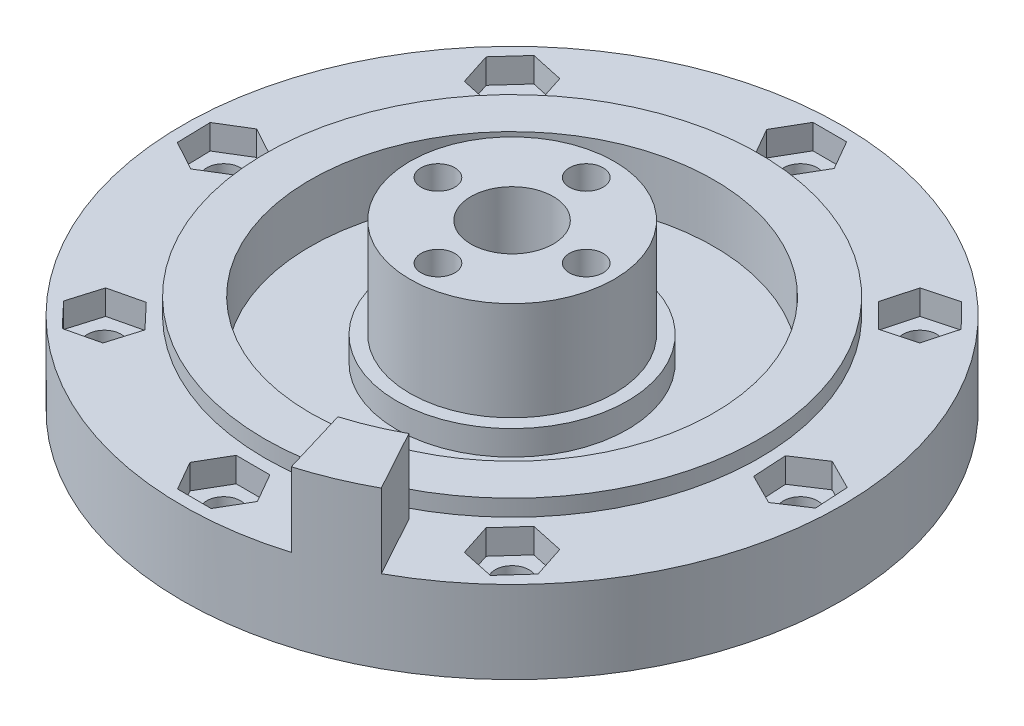
from build123d import *

# Parameters (mm, degrees)
SKETCH1_R           = 40
BOSS_EXTRUDE1_DEPTH = 10
SKETCH2_R           = 24.5
CUT_EXTRUDE1_DEPTH  = 5
BOSS_EXTRUDE2_START = 2
SKETCH3_R           = 30
SKETCH3_R_2         = 24.5
BOSS_EXTRUDE2_DEPTH = 2
SKETCH4_R           = 14
BOSS_EXTRUDE3_DEPTH = 3
SKETCH5_R           = 12.4
BOSS_EXTRUDE4_DEPTH = 12
SKETCH6_R           = 2.05
CUT_EXTRUDE2_DEPTH  = 61
SKETCH7_R           = 5
CUT_EXTRUDE3_DEPTH  = 61
CUT_EXTRUDE6_REACH  = 59.446
SKETCH9_R           = 2.05
CUT_EXTRUDE7_DEPTH  = 3
BOSS_EXTRUDE5_DEPTH = 9


with BuildPart() as part:
    # Sketch1 → Boss-Extrude1 (new body)
    with BuildSketch(Plane(origin=(0, 0, 0), x_dir=(1, 0, 0), z_dir=(0, 1, 0))):
        with Locations(Location((0, 0, 0), (0, 0, 270))):
            Circle(SKETCH1_R)
    extrude(amount=BOSS_EXTRUDE1_DEPTH)

    # Sketch2 → Cut-Extrude1 (cut)
    with BuildSketch(Plane(origin=(0, 10, 0), x_dir=(1, 0, 0), z_dir=(0, 1, 0))):
        with Locations(Location((0, 0, 0), (0, 0, 270))):
            Circle(SKETCH2_R)
    extrude(amount=-CUT_EXTRUDE1_DEPTH, mode=Mode.SUBTRACT)

    # Sketch3 → Boss-Extrude2 (add)
    with BuildSketch(Plane(origin=(0, 10, 0), x_dir=(1, 0, 0), z_dir=(0, 1, 0)).offset(BOSS_EXTRUDE2_START)):
        with Locations(Location((0, 0, 0), (0, 0, 270))):
            Circle(SKETCH3_R)
        with Locations(Location((0, 0, 0), (0, 0, 270))):
            Circle(SKETCH3_R_2, mode=Mode.SUBTRACT)
    extrude(amount=-BOSS_EXTRUDE2_DEPTH)

    # Sketch4 → Boss-Extrude3 (add)
    with BuildSketch(Plane(origin=(0, 5, 0), x_dir=(1, 0, 0), z_dir=(0, 1, 0))):
        with Locations(Location((0, 0, 0), (0, 0, 270))):
            Circle(SKETCH4_R)
    extrude(amount=BOSS_EXTRUDE3_DEPTH)

    # Sketch5 → Boss-Extrude4 (add)
    with BuildSketch(Plane(origin=(0, 8, 0), x_dir=(1, 0, 0), z_dir=(0, 1, 0))):
        with Locations(Location((0, 0, 0), (0, 0, 270))):
            Circle(SKETCH5_R)
    extrude(amount=BOSS_EXTRUDE4_DEPTH)

    # Sketch6 → Cut-Extrude2 (cut, through all)
    with BuildSketch(Plane(origin=(0, 20, 0), x_dir=(1, 0, 0), z_dir=(0, 1, 0))):
        with Locations(Location((-9, 0, 0), (0, 0, 270))):
            Circle(SKETCH6_R)
        with Locations(Location((0, 9, 0), (0, 0, 270))):
            Circle(SKETCH6_R)
        with Locations(Location((9, 0, 0), (0, 0, 270))):
            Circle(SKETCH6_R)
        with Locations(Location((0, -9, 0), (0, 0, 270))):
            Circle(SKETCH6_R)
    extrude(amount=-CUT_EXTRUDE2_DEPTH, mode=Mode.SUBTRACT)

    # Sketch7 → Cut-Extrude3 (cut, through all)
    with BuildSketch(Plane(origin=(0, 20, 0), x_dir=(1, 0, 0), z_dir=(0, 1, 0))):
        with Locations(Location((0, 0, 0), (0, 0, 270))):
            Circle(SKETCH7_R)
    extrude(amount=-CUT_EXTRUDE3_DEPTH, mode=Mode.SUBTRACT)

    # Sketch9 → Cut-Extrude6 (cut, up to next)
    with BuildSketch(Plane(origin=(0, 10, 0), x_dir=(1, 0, 0), z_dir=(0, 1, 0)), mode=Mode.PRIVATE) as cut_extrude6_sk1:
        with Locations(Location((0, 35, 0), (0, 0, 270))):
            Circle(SKETCH9_R)
    cut_extrude6_tool1 = extrude(cut_extrude6_sk1.sketch, amount=-CUT_EXTRUDE6_REACH, mode=Mode.PRIVATE) & part.part
    # Sketch9 → Cut-Extrude6 (cut, up to next)
    with BuildSketch(Plane(origin=(0, 10, 0), x_dir=(1, 0, 0), z_dir=(0, 1, 0)), mode=Mode.PRIVATE) as cut_extrude6_sk2:
        with Locations(Location((35, 0, 0), (0, 0, 270))):
            Circle(SKETCH9_R)
    cut_extrude6_tool2 = extrude(cut_extrude6_sk2.sketch, amount=-CUT_EXTRUDE6_REACH, mode=Mode.PRIVATE) & part.part
    # Sketch9 → Cut-Extrude6 (cut, up to next)
    with BuildSketch(Plane(origin=(0, 10, 0), x_dir=(1, 0, 0), z_dir=(0, 1, 0)), mode=Mode.PRIVATE) as cut_extrude6_sk3:
        with Locations(Location((0, -35, 0), (0, 0, 270))):
            Circle(SKETCH9_R)
    cut_extrude6_tool3 = extrude(cut_extrude6_sk3.sketch, amount=-CUT_EXTRUDE6_REACH, mode=Mode.PRIVATE) & part.part
    # Sketch9 → Cut-Extrude6 (cut, up to next)
    with BuildSketch(Plane(origin=(0, 10, 0), x_dir=(1, 0, 0), z_dir=(0, 1, 0)), mode=Mode.PRIVATE) as cut_extrude6_sk4:
        with Locations(Location((-35, 0, 0), (0, 0, 270))):
            Circle(SKETCH9_R)
    cut_extrude6_tool4 = extrude(cut_extrude6_sk4.sketch, amount=-CUT_EXTRUDE6_REACH, mode=Mode.PRIVATE) & part.part
    # Sketch9 → Cut-Extrude6 (cut, up to next)
    with BuildSketch(Plane(origin=(0, 10, 0), x_dir=(1, 0, 0), z_dir=(0, 1, 0)), mode=Mode.PRIVATE) as cut_extrude6_sk5:
        with Locations(Location((-24.748737342, 24.748737342, 0), (0, 0, 270))):
            Circle(SKETCH9_R)
    cut_extrude6_tool5 = extrude(cut_extrude6_sk5.sketch, amount=-CUT_EXTRUDE6_REACH, mode=Mode.PRIVATE) & part.part
    # Sketch9 → Cut-Extrude6 (cut, up to next)
    with BuildSketch(Plane(origin=(0, 10, 0), x_dir=(1, 0, 0), z_dir=(0, 1, 0)), mode=Mode.PRIVATE) as cut_extrude6_sk6:
        with Locations(Location((24.748737342, 24.748737342, 0), (0, 0, 270))):
            Circle(SKETCH9_R)
    cut_extrude6_tool6 = extrude(cut_extrude6_sk6.sketch, amount=-CUT_EXTRUDE6_REACH, mode=Mode.PRIVATE) & part.part
    # Sketch9 → Cut-Extrude6 (cut, up to next)
    with BuildSketch(Plane(origin=(0, 10, 0), x_dir=(1, 0, 0), z_dir=(0, 1, 0)), mode=Mode.PRIVATE) as cut_extrude6_sk7:
        with Locations(Location((24.748737342, -24.748737342, 0), (0, 0, 270))):
            Circle(SKETCH9_R)
    cut_extrude6_tool7 = extrude(cut_extrude6_sk7.sketch, amount=-CUT_EXTRUDE6_REACH, mode=Mode.PRIVATE) & part.part
    # Sketch9 → Cut-Extrude6 (cut, up to next)
    with BuildSketch(Plane(origin=(0, 10, 0), x_dir=(1, 0, 0), z_dir=(0, 1, 0)), mode=Mode.PRIVATE) as cut_extrude6_sk8:
        with Locations(Location((-24.748737342, -24.748737342, 0), (0, 0, 270))):
            Circle(SKETCH9_R)
    cut_extrude6_tool8 = extrude(cut_extrude6_sk8.sketch, amount=-CUT_EXTRUDE6_REACH, mode=Mode.PRIVATE) & part.part
    add(cut_extrude6_tool1.solids().sort_by_distance((0, 10, -35))[0], mode=Mode.SUBTRACT)
    add(cut_extrude6_tool2.solids().sort_by_distance((35, 10, 0))[0], mode=Mode.SUBTRACT)
    add(cut_extrude6_tool3.solids().sort_by_distance((0, 10, 35))[0], mode=Mode.SUBTRACT)
    add(cut_extrude6_tool4.solids().sort_by_distance((-35, 10, 0))[0], mode=Mode.SUBTRACT)
    add(cut_extrude6_tool5.solids().sort_by_distance((-24.748737, 10, -24.748737))[0], mode=Mode.SUBTRACT)
    add(cut_extrude6_tool6.solids().sort_by_distance((24.748737, 10, -24.748737))[0], mode=Mode.SUBTRACT)
    add(cut_extrude6_tool7.solids().sort_by_distance((24.748737, 10, 24.748737))[0], mode=Mode.SUBTRACT)
    add(cut_extrude6_tool8.solids().sort_by_distance((-24.748737, 10, 24.748737))[0], mode=Mode.SUBTRACT)

    # Sketch10 → Cut-Extrude7 (cut)
    with BuildSketch(Plane(origin=(0, 10, 0), x_dir=(1, 0, 0), z_dir=(0, 1, 0))):
        Polygon((2.044293101, 31.44694511), (4.099182346, 34.993882313), (2.054889246, 38.546937203), (-2.044293101, 38.55305489), (-4.099182346, 35.006117687), (-2.054889246, 31.453062797), align=None)
        Polygon((23.680683804, 20.791137693), (27.642092406, 21.844976021), (28.710145944, 25.802575669), (25.816790879, 28.70633699), (21.855382277, 27.652498662), (20.78732874, 23.694899014), align=None)
        Polygon((31.573449102, -2.24990717), (35.235201316, -4.09243371), (38.661752215, -1.84252654), (38.426550898, 2.24990717), (34.764798684, 4.09243371), (31.338247785, 1.84252654), align=None)
        Polygon((20.739798525, -23.89331762), (22.003452724, -27.792870338), (26.01239154, -28.648290059), (28.757676158, -25.604157063), (27.494021959, -21.704604345), (23.485083143, -20.849184624), align=None)
        Polygon((2.058274344, -31.455026085), (-2.040900294, -31.444995172), (-4.099174638, -34.989969087), (-2.058274344, -38.544973915), (2.040900294, -38.555004828), (4.099174638, -35.010030913), align=None)
        Polygon((-20.760867622, -23.799933658), (-23.576490575, -20.820739015), (-27.564360295, -21.769542699), (-28.736607062, -25.697541025), (-25.920984108, -28.676735668), (-21.933114388, -27.727931984), align=None)
        Polygon((-31.399076536, -1.958745399), (-31.503214993, 2.139118497), (-35.104138457, 4.097863897), (-38.600923464, 1.958745399), (-38.496785007, -2.139118497), (-34.895861543, -4.097863897), align=None)
        Polygon((-23.495263392, 20.845900375), (-20.742044406, 23.882859142), (-21.995518356, 27.785696109), (-26.002211292, 28.651574308), (-28.755430277, 25.614615541), (-27.501956327, 21.711778574), align=None)
    extrude(amount=-CUT_EXTRUDE7_DEPTH, mode=Mode.SUBTRACT)

    # Sketch11 → Boss-Extrude5 (add)
    with BuildSketch(Plane(origin=(0, 10, 0), x_dir=(1, 0, 0), z_dir=(0, 1, 0))):
        with BuildLine():
            Line((9.080620819, -30.218963387), (11.511280004, -38.307837745))
            ThreePointArc((11.511280004, -38.307837745), (15.444999622, -36.897858836), (19.210154537, -35.085181525))
            Line((19.210154537, -35.085181525), (15.153842941, -27.676785701))
            ThreePointArc((15.153842941, -27.676785701), (12.18371763, -29.106707944), (9.080620819, -30.218963387))
        make_face()
    extrude(amount=BOSS_EXTRUDE5_DEPTH)


solid = part.part
